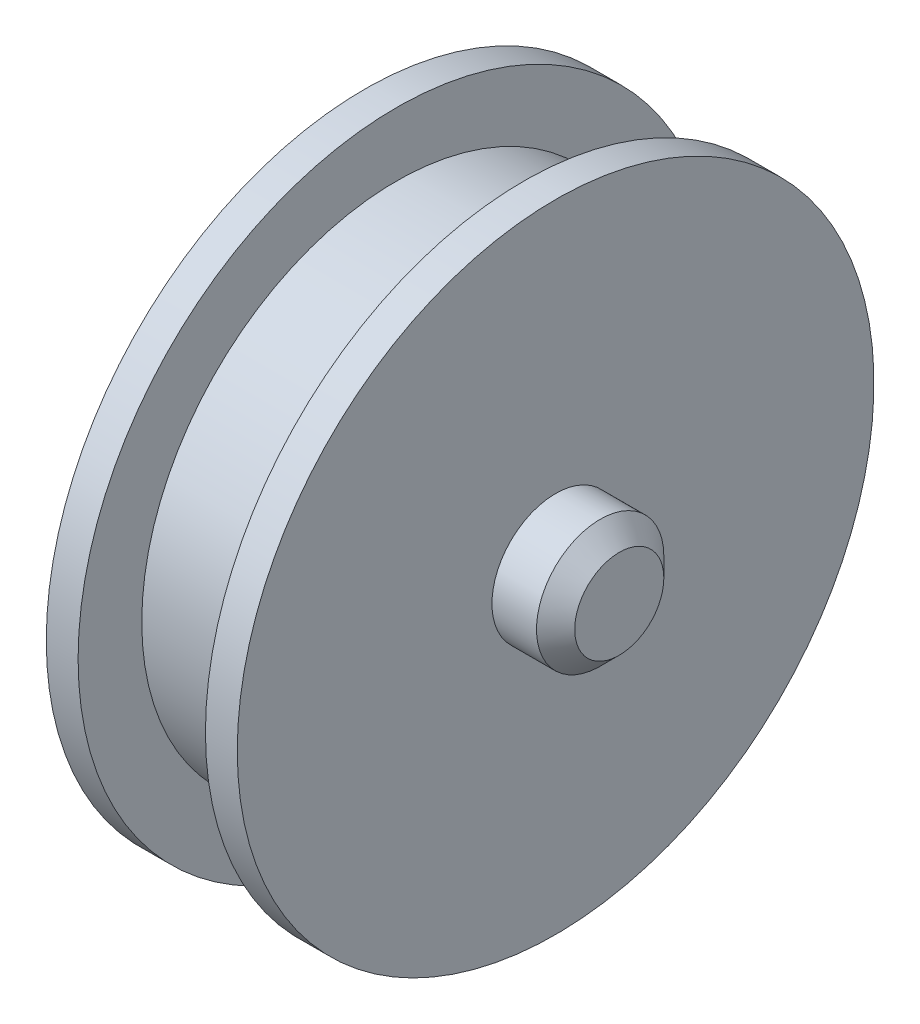
from build123d import *

# Parameters (mm, degrees)
ESBO_O2_R                = 1
RESSALTO_EXTRUS_O1_DEPTH = 1
RESSALTO_EXTRUS_O2_START = 1
ESBO_O4_R                = 1
RESSALTO_EXTRUS_O2_DEPTH = 1
CHANFRO1_SIZE            = 0.3
CHANFRO2_SIZE            = 0.3


with BuildPart() as part:
    # Esboço1 → Revolução2 (revolve)
    with BuildSketch(Plane.XY, mode=Mode.PRIVATE) as revolu_o2_sk:
        Polygon((-1, 5), (-1.5, 5), (-1.5, 0), (1.5, 0), (1.5, 5), (1, 5), (1, 4), (0, 4), (-1, 4), align=None)
    revolve(revolu_o2_sk.sketch.rotate(Axis((0, 0, 0), (1, 0, 0)), 90), axis=Axis((0, 0, 0), (1, 0, 0)))

    # Esboço2 → Ressalto-extrusão1 (add)
    with BuildSketch(Plane.ZY.offset(1.5)):
        Circle(ESBO_O2_R)
    extrude(amount=RESSALTO_EXTRUS_O1_DEPTH)

    # Esboço4 → Ressalto-extrusão2 (add)
    with BuildSketch(Plane(origin=(1.5, 0, 0), x_dir=(0, 0, -1), z_dir=(1, 0, 0)).offset(RESSALTO_EXTRUS_O2_START)):
        with Locations(Location((0, 0, 0), (0, 0, 180))):
            Circle(ESBO_O4_R)
    extrude(amount=-RESSALTO_EXTRUS_O2_DEPTH)

    # Chanfro1
    chanfro1_edges = [part.edges().sort_by_distance(p)[0] for p in [
        (-2.5, 0, -1),
    ]]
    chamfer(chanfro1_edges, length=CHANFRO1_SIZE)

    # Chanfro2
    chanfro2_edges = [part.edges().sort_by_distance(p)[0] for p in [
        (2.5, 0, -1),
    ]]
    chamfer(chanfro2_edges, length=CHANFRO2_SIZE)


solid = part.part
